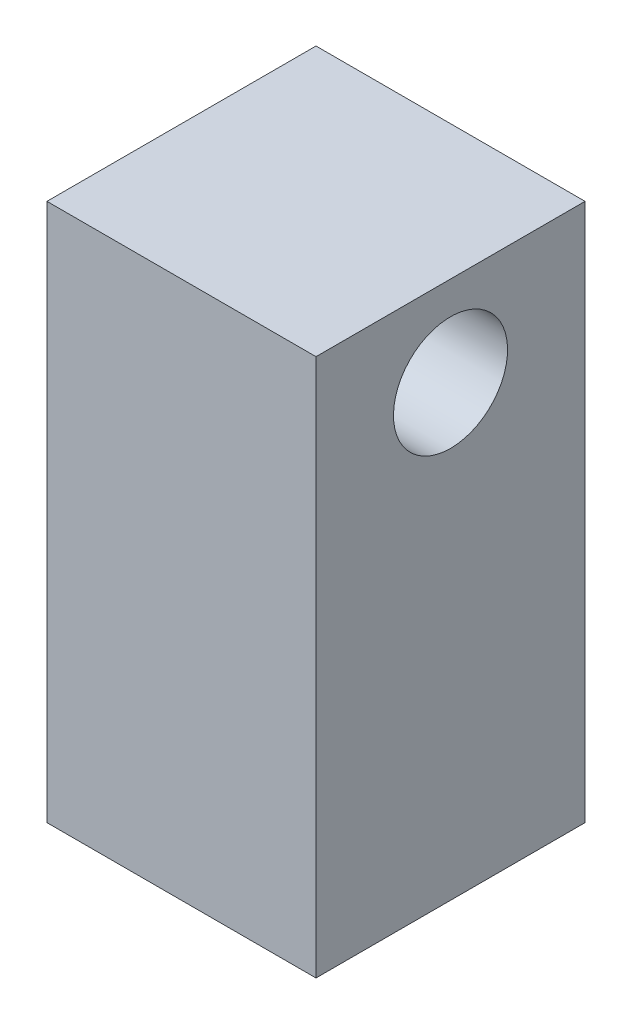
from build123d import *

# Parameters (mm, degrees)
SKETCH1_W           = 9.525
SKETCH1_H           = 19.05
BOSS_EXTRUDE1_DEPTH = 9.525
SKETCH2_R           = 1.28905
CUT_EXTRUDE1_DEPTH  = 12.7
SKETCH4_R           = 2.0193
CUT_EXTRUDE2_DEPTH  = 17.497783942


with BuildPart() as part:
    # Sketch1 → Boss-Extrude1 (new body)
    with BuildSketch(Plane.XY):
        Rectangle(SKETCH1_W, SKETCH1_H)
    extrude(amount=BOSS_EXTRUDE1_DEPTH)

    # Sketch2 → Cut-Extrude1 (cut)
    with BuildSketch(Plane.XZ.offset(9.525)):
        with Locations(Location((0, 4.7625, 0), (0, 0, 270))):
            Circle(SKETCH2_R)
    extrude(amount=-CUT_EXTRUDE1_DEPTH, mode=Mode.SUBTRACT)

    # Sketch4 → Cut-Extrude2 (cut, through all)
    with BuildSketch(Plane.ZY.offset(4.7625)):
        with Locations(Location((4.7625, 6.35, 0), (0, 0, 270))):
            Circle(SKETCH4_R)
    extrude(amount=-CUT_EXTRUDE2_DEPTH, mode=Mode.SUBTRACT)


solid = part.part
